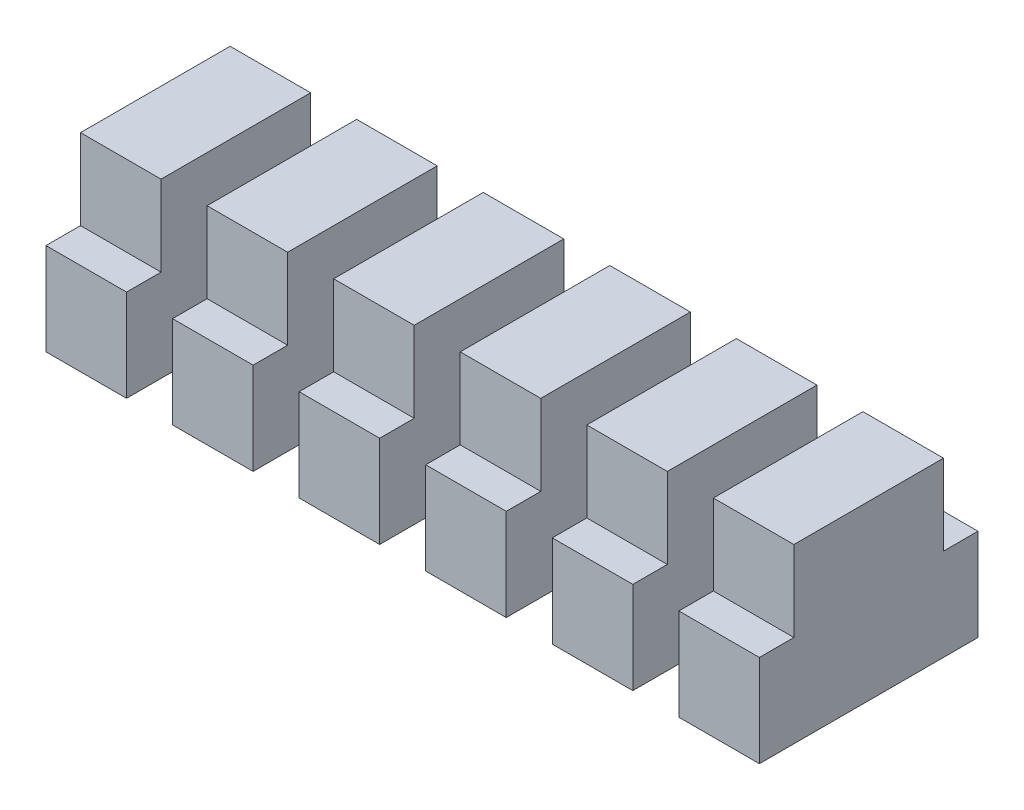
from build123d import *

# Parameters (mm, degrees)
BOSS_EXTRUDE1_DEPTH = 8
BOSS_EXTRUDE2_DEPTH = 7


with BuildPart() as part:
    # Sketch1 → Boss-Extrude1 (new body)
    with BuildSketch(Plane(origin=(0, 0, 0), x_dir=(1, 0, 0), z_dir=(0, 1, 0))):
        Polygon((-13, 2.5), (-13, 9.5), (-20, 9.5), (-20, 2.5), (-24, 2.5), (-24, 9.5), (-31, 9.5), (-31, -9.5), (-24, -9.5), (-24, -2.5), (-20, -2.5), (-20, -9.5), (-13, -9.5), (-13, -2.5), (-9, -2.5), (-9, -9.5), (-2, -9.5), (-2, -2.5), (2, -2.5), (2, -9.5), (9, -9.5), (9, -2.5), (13, -2.5), (13, -9.5), (20, -9.5), (20, -2.5), (24, -2.5), (24, -9.5), (31, -9.5), (31, 9.5), (24, 9.5), (24, 2.5), (20, 2.5), (20, 9.5), (13, 9.5), (13, 2.5), (9, 2.5), (9, 9.5), (2, 9.5), (2, 2.5), (-2, 2.5), (-2, 9.5), (-9, 9.5), (-9, 2.5), align=None)
    extrude(amount=-BOSS_EXTRUDE1_DEPTH)

    # Sketch2 → Boss-Extrude2 (add)
    with BuildSketch(Plane(origin=(0, 0, 0), x_dir=(1, 0, 0), z_dir=(0, 1, 0))):
        Polygon((-31, 6.5), (-24, 6.5), (-24, 2.5), (-24, -2.5), (-24, -6.5), (-31, -6.5), align=None)
        Polygon((-20, 6.5), (-13, 6.5), (-13, 2.5), (-13, -2.5), (-13, -6.5), (-20, -6.5), (-20, -2.5), (-20, 2.5), align=None)
        Polygon((-9, 6.5), (-2, 6.5), (-2, 2.5), (-2, -2.5), (-2, -6.5), (-9, -6.5), (-9, -2.5), (-9, 2.5), align=None)
        Polygon((2, 6.5), (9, 6.5), (9, 2.5), (9, -2.5), (9, -6.5), (2, -6.5), (2, -2.5), (2, 2.5), align=None)
        Polygon((13, 6.5), (20, 6.5), (20, 2.5), (20, -2.5), (20, -6.5), (13, -6.5), (13, -2.5), (13, 2.5), align=None)
        Polygon((24, 6.5), (31, 6.5), (31, -6.5), (24, -6.5), (24, -2.5), (24, 2.5), align=None)
    extrude(amount=BOSS_EXTRUDE2_DEPTH)


solid = part.part
